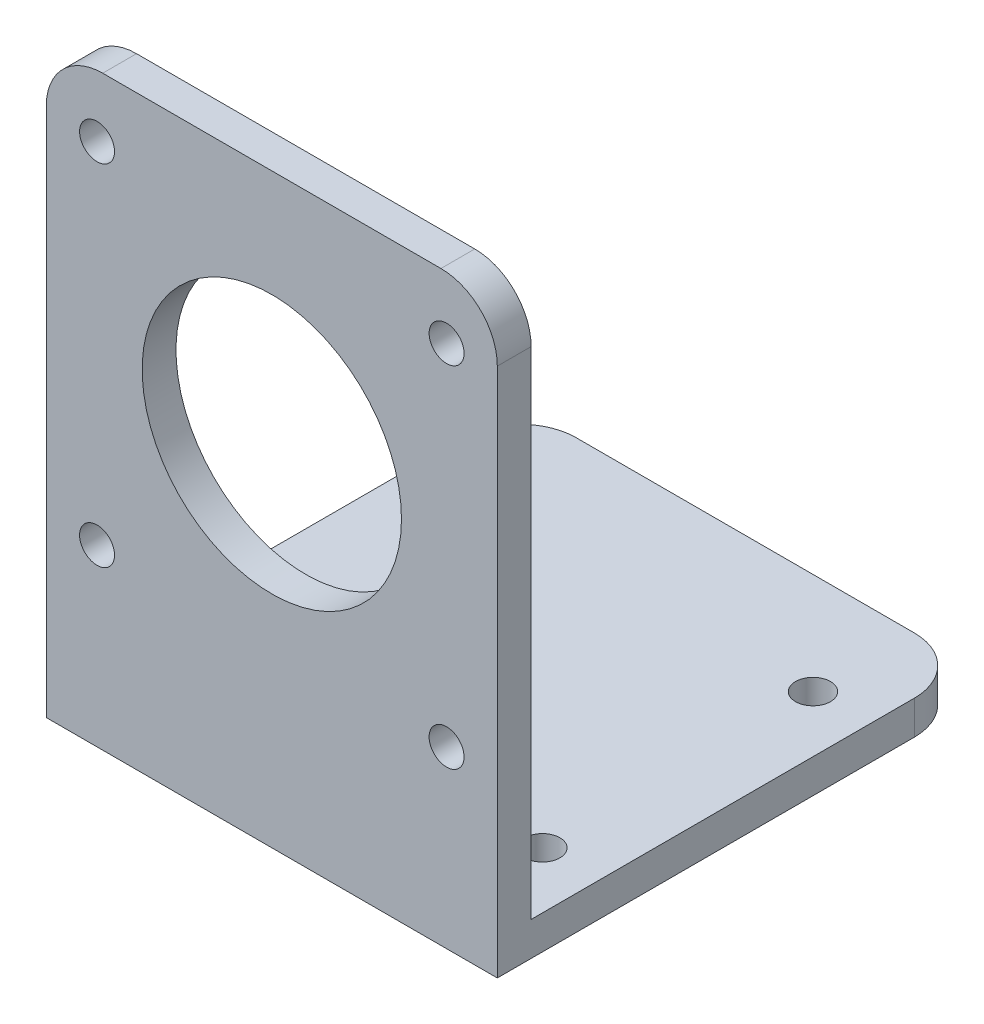
from build123d import *

# Parameters (mm, degrees)
EXTRUDE_1_DEPTH     = 20
CUT_EXTRUDE_1_REACH = 71.771
SKETCH_2_R          = 1.55
SKETCH_2_R_2        = 11.5
CUT_EXTRUDE_2_REACH = 71.771
SKETCH_3_R          = 1.55
FILLET_1_R          = 5


with BuildPart() as part:
    # 草图1 → 凸台-拉伸1 (new, symmetric)
    with BuildSketch(Plane(origin=(0, 0, 0), x_dir=(0, 0, -1), z_dir=(1, 0, 0))):
        Polygon((0, 0), (0, 52), (3, 52), (3, 3), (42, 3), (42, 0), align=None)
    extrude(amount=EXTRUDE_1_DEPTH, both=True)

    # 草图2 → 切除-拉伸1 (cut, up to next)
    with BuildSketch(Plane.XY, mode=Mode.PRIVATE) as cut_extrude_1_sk1:
        with Locations((15.5, 46.5)):
            Circle(SKETCH_2_R)
    cut_extrude_1_tool1 = extrude(cut_extrude_1_sk1.sketch, amount=-CUT_EXTRUDE_1_REACH, mode=Mode.PRIVATE) & part.part
    # 草图2 → 切除-拉伸1 (cut, up to next)
    with BuildSketch(Plane.XY, mode=Mode.PRIVATE) as cut_extrude_1_sk2:
        with Locations((15.5, 15.5)):
            Circle(SKETCH_2_R)
    cut_extrude_1_tool2 = extrude(cut_extrude_1_sk2.sketch, amount=-CUT_EXTRUDE_1_REACH, mode=Mode.PRIVATE) & part.part
    # 草图2 → 切除-拉伸1 (cut, up to next)
    with BuildSketch(Plane.XY, mode=Mode.PRIVATE) as cut_extrude_1_sk3:
        with Locations(Location((-15.5, 15.5, 0), (0, 0, 90))):
            Circle(SKETCH_2_R)
    cut_extrude_1_tool3 = extrude(cut_extrude_1_sk3.sketch, amount=-CUT_EXTRUDE_1_REACH, mode=Mode.PRIVATE) & part.part
    # 草图2 → 切除-拉伸1 (cut, up to next)
    with BuildSketch(Plane.XY, mode=Mode.PRIVATE) as cut_extrude_1_sk4:
        with Locations(Location((-15.5, 46.5, 0), (0, 0, 90))):
            Circle(SKETCH_2_R)
    cut_extrude_1_tool4 = extrude(cut_extrude_1_sk4.sketch, amount=-CUT_EXTRUDE_1_REACH, mode=Mode.PRIVATE) & part.part
    # 草图2 → 切除-拉伸1 (cut, up to next)
    with BuildSketch(Plane.XY, mode=Mode.PRIVATE) as cut_extrude_1_sk5:
        with Locations((0, 31)):
            Circle(SKETCH_2_R_2)
    cut_extrude_1_tool5 = extrude(cut_extrude_1_sk5.sketch, amount=-CUT_EXTRUDE_1_REACH, mode=Mode.PRIVATE) & part.part
    add(cut_extrude_1_tool1.solids().sort_by_distance((15.5, 46.5, 0))[0], mode=Mode.SUBTRACT)
    add(cut_extrude_1_tool2.solids().sort_by_distance((15.5, 15.5, 0))[0], mode=Mode.SUBTRACT)
    add(cut_extrude_1_tool3.solids().sort_by_distance((-15.5, 15.5, 0))[0], mode=Mode.SUBTRACT)
    add(cut_extrude_1_tool4.solids().sort_by_distance((-15.5, 46.5, 0))[0], mode=Mode.SUBTRACT)
    add(cut_extrude_1_tool5.solids().sort_by_distance((0, 31, 0))[0], mode=Mode.SUBTRACT)

    # 草图3 → 切除-拉伸2 (cut, up to next)
    with BuildSketch(Plane(origin=(0, 0, 0), x_dir=(1, 0, 0), z_dir=(0, 1, 0)), mode=Mode.PRIVATE) as cut_extrude_2_sk1:
        with Locations(Location((15, 33, 0), (0, 0, 270))):
            Circle(SKETCH_3_R)
    cut_extrude_2_tool1 = extrude(cut_extrude_2_sk1.sketch, amount=CUT_EXTRUDE_2_REACH, mode=Mode.PRIVATE) & part.part
    # 草图3 → 切除-拉伸2 (cut, up to next)
    with BuildSketch(Plane(origin=(0, 0, 0), x_dir=(1, 0, 0), z_dir=(0, 1, 0)), mode=Mode.PRIVATE) as cut_extrude_2_sk2:
        with Locations(Location((15, 9, 0), (0, 0, 270))):
            Circle(SKETCH_3_R)
    cut_extrude_2_tool2 = extrude(cut_extrude_2_sk2.sketch, amount=CUT_EXTRUDE_2_REACH, mode=Mode.PRIVATE) & part.part
    # 草图3 → 切除-拉伸2 (cut, up to next)
    with BuildSketch(Plane(origin=(0, 0, 0), x_dir=(1, 0, 0), z_dir=(0, 1, 0)), mode=Mode.PRIVATE) as cut_extrude_2_sk3:
        with Locations(Location((-15, 9, 0), (0, 0, 90))):
            Circle(SKETCH_3_R)
    cut_extrude_2_tool3 = extrude(cut_extrude_2_sk3.sketch, amount=CUT_EXTRUDE_2_REACH, mode=Mode.PRIVATE) & part.part
    # 草图3 → 切除-拉伸2 (cut, up to next)
    with BuildSketch(Plane(origin=(0, 0, 0), x_dir=(1, 0, 0), z_dir=(0, 1, 0)), mode=Mode.PRIVATE) as cut_extrude_2_sk4:
        with Locations(Location((-15, 33, 0), (0, 0, 90))):
            Circle(SKETCH_3_R)
    cut_extrude_2_tool4 = extrude(cut_extrude_2_sk4.sketch, amount=CUT_EXTRUDE_2_REACH, mode=Mode.PRIVATE) & part.part
    add(cut_extrude_2_tool1.solids().sort_by_distance((15, 0, -33))[0], mode=Mode.SUBTRACT)
    add(cut_extrude_2_tool2.solids().sort_by_distance((15, 0, -9))[0], mode=Mode.SUBTRACT)
    add(cut_extrude_2_tool3.solids().sort_by_distance((-15, 0, -9))[0], mode=Mode.SUBTRACT)
    add(cut_extrude_2_tool4.solids().sort_by_distance((-15, 0, -33))[0], mode=Mode.SUBTRACT)

    # 圆角1
    fillet_1_edges = [part.edges().sort_by_distance(p)[0] for p in [
        (-20, 52, -1.5),
        (20, 52, -1.5),
        (20, 1.5, -42),
        (-20, 1.5, -42),
    ]]
    fillet(fillet_1_edges, radius=FILLET_1_R)


solid = part.part
